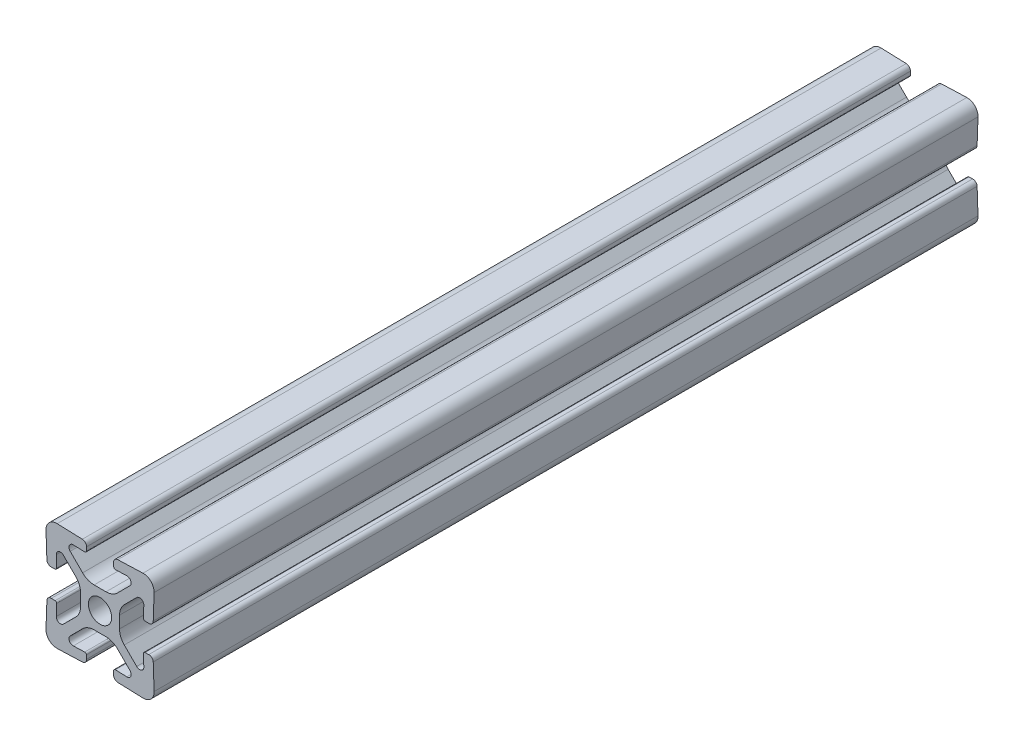
from build123d import *

# Parameters (mm, degrees)
BOSS_EXTRUDE1_DEPTH = 76.2
CIRPATTERN1_COUNT   = 4


with BuildPart() as part:
    # Sketch3 → Boss-Extrude1 (new, symmetric)
    with BuildSketch(Plane.XY):
        with BuildLine():
            Line((-2.524916986, 8.30911066), (-2.500487338, 9.008684239))
            ThreePointArc((-2.500487338, 9.008684239), (-2.714917039, 9.582202525), (-3.272080403, 9.836116498))
            Line((-3.272080403, 9.836116498), (-7.930201007, 9.998781654))
            ThreePointArc((-7.930201007, 9.998781654), (-9.414213562, 9.414213562), (-9.998781654, 7.930201007))
            Line((-9.998781654, 7.930201007), (-9.836116498, 3.272080403))
            ThreePointArc((-9.836116498, 3.272080403), (-9.582202525, 2.714917039), (-9.008684239, 2.500487338))
            Line((-9.008684239, 2.500487338), (-8.30911066, 2.524916986))
            ThreePointArc((-8.30911066, 2.524916986), (-8.100174399, 2.620134726), (-8.019763261, 2.835204083))
            Line((-8.019763261, 2.835204083), (-8.093719461, 4.953032548))
            ThreePointArc((-8.093719461, 4.953032548), (-7.631170264, 5.686128657), (-6.779559917, 5.52444538))
            Line((-6.779559917, 5.52444538), (-4.478679656, 3.22356512))
            ThreePointArc((-4.478679656, 3.22356512), (-3.828361402, 2.250295073), (-3.6, 1.102244776))
            Line((-3.6, 1.102244776), (-3.6, 0))
            Line((-3.6, 0), (-2.15, 0))
            ThreePointArc((-2.15, 0), (-1.52027958, 1.52027958), (0, 2.15))
            Line((0, 2.15), (0, 3.6))
            Line((0, 3.6), (-1.102244776, 3.6))
            ThreePointArc((-1.102244776, 3.6), (-2.250295073, 3.828361402), (-3.22356512, 4.478679656))
            Line((-3.22356512, 4.478679656), (-5.52444538, 6.779559917))
            ThreePointArc((-5.52444538, 6.779559917), (-5.686128657, 7.631170264), (-4.953032548, 8.093719461))
            Line((-4.953032548, 8.093719461), (-2.835204083, 8.019763261))
            ThreePointArc((-2.835204083, 8.019763261), (-2.620134726, 8.100174399), (-2.524916986, 8.30911066))
        make_face()
    boss_extrude1 = extrude(amount=BOSS_EXTRUDE1_DEPTH, both=True)

    # CirPattern1: Boss-Extrude1 ×4 about axis
    cirpattern1_axis = Axis((0, 0, 0), (0, 0, 1))
    for i in range(1, CIRPATTERN1_COUNT):
        add(boss_extrude1.rotate(cirpattern1_axis, i * 360 / CIRPATTERN1_COUNT))


solid = part.part
